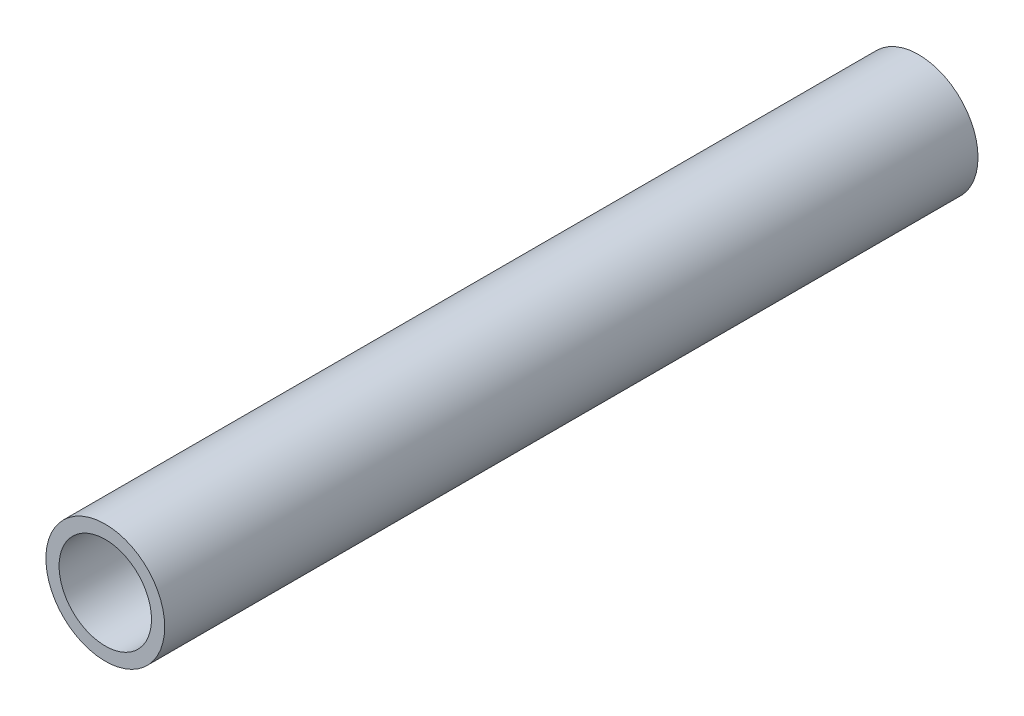
from build123d import *

# Parameters (mm, degrees)
SKETCH1_R           = 9
SKETCH1_R_2         = 7
BOSS_EXTRUDE1_DEPTH = 61.61


with BuildPart() as part:
    # Sketch1 → Boss-Extrude1 (new, symmetric)
    with BuildSketch(Plane.XY):
        Circle(SKETCH1_R)
        Circle(SKETCH1_R_2, mode=Mode.SUBTRACT)
    extrude(amount=BOSS_EXTRUDE1_DEPTH, both=True)


solid = part.part
